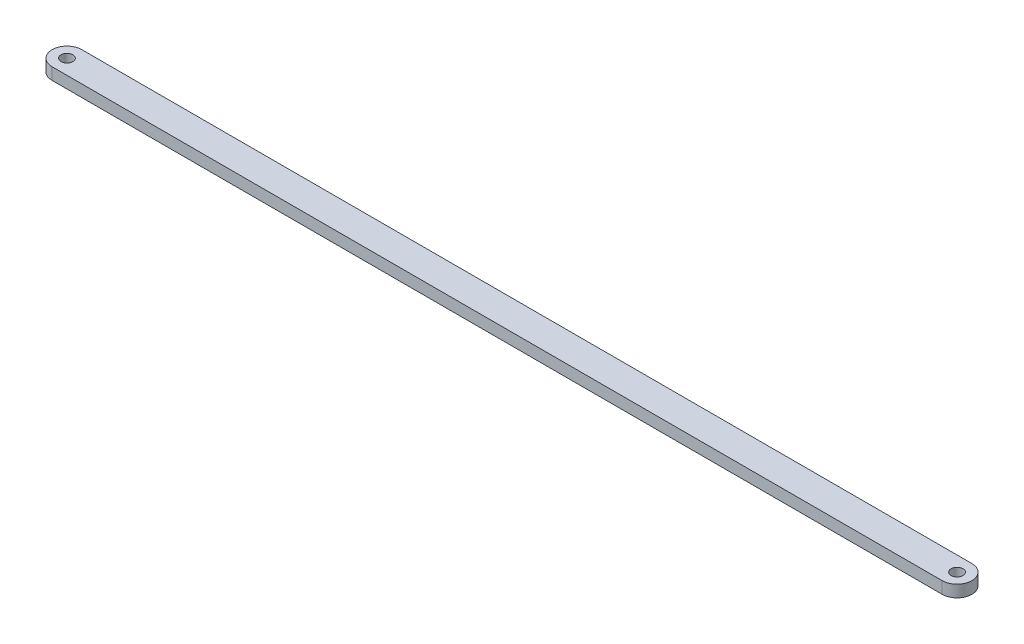
from build123d import *

# Parameters (mm, degrees)
SKETCH1_R           = 1
BOSS_EXTRUDE1_DEPTH = 2


with BuildPart() as part:
    # Sketch1 → Boss-Extrude1 (new body)
    with BuildSketch(Plane(origin=(0, 0, 0), x_dir=(1, 0, 0), z_dir=(0, 1, 0))):
        with BuildLine():
            Line((-10, 2.5), (140, 2.5))
            ThreePointArc((140, 2.5), (142.5, 0), (140, -2.5))
            Line((140, -2.5), (-10, -2.5))
            ThreePointArc((-10, -2.5), (-12.5, 0), (-10, 2.5))
        make_face()
        with Locations(Location((140, 0, 0), (0, 0, 270))):
            Circle(SKETCH1_R, mode=Mode.SUBTRACT)
        with Locations(Location((-10, 0, 0), (0, 0, 270))):
            Circle(SKETCH1_R, mode=Mode.SUBTRACT)
    extrude(amount=BOSS_EXTRUDE1_DEPTH)


solid = part.part
